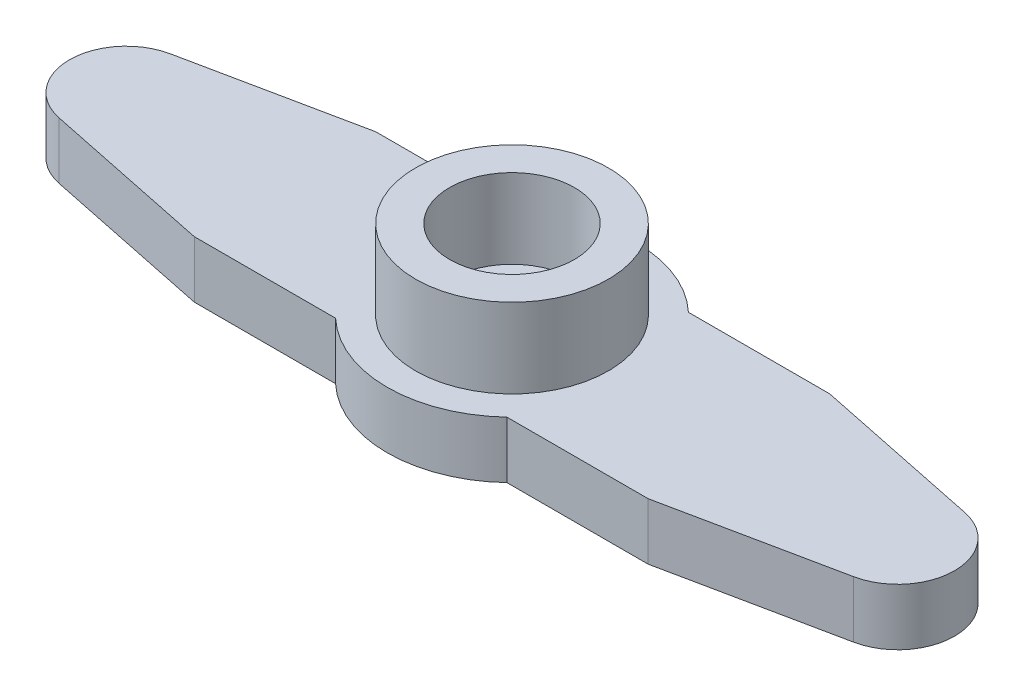
from build123d import *

# Parameters (mm, degrees)
BOSS_EXTRUDE1_DEPTH = 2.5
SKETCH2_R           = 1.5
CUT_EXTRUDE1_DEPTH  = 10
SKETCH3_R           = 4.25
SKETCH3_R_2         = 2.75
BOSS_EXTRUDE2_DEPTH = 3.5
SKETCH4_R           = 3.75
SKETCH4_R_2         = 3.25
BOSS_EXTRUDE3_DEPTH = 0.5


with BuildPart() as part:
    # Sketch1 → Boss-Extrude1 (new body)
    with BuildSketch(Plane(origin=(0, 0, 0), x_dir=(1, 0, 0), z_dir=(0, 1, 0))):
        with BuildLine():
            Line((10, -4), (17.506131517, -2.448230154))
            ThreePointArc((17.506131517, -2.448230154), (19.5, 0), (17.506131517, 2.448230154))
            Line((17.506131517, 2.448230154), (10, 4))
            Line((10, 4), (3.774917218, 4))
            ThreePointArc((3.774917218, 4), (0, 5.5), (-3.774917218, 4))
            Line((-3.774917218, 4), (-10, 4))
            Line((-10, 4), (-17.506131517, 2.448230154))
            ThreePointArc((-17.506131517, 2.448230154), (-19.5, 0), (-17.506131517, -2.448230154))
            Line((-17.506131517, -2.448230154), (-10, -4))
            Line((-10, -4), (-3.774917218, -4))
            ThreePointArc((-3.774917218, -4), (0, -5.5), (3.774917218, -4))
            Line((3.774917218, -4), (10, -4))
        make_face()
    extrude(amount=BOSS_EXTRUDE1_DEPTH)

    # Sketch2 → Cut-Extrude1 (cut)
    with BuildSketch(Plane(origin=(0, 2.5, 0), x_dir=(1, 0, 0), z_dir=(0, 1, 0))):
        with Locations(Location((0, 0, 0), (0, 0, 270))):
            Circle(SKETCH2_R)
    extrude(amount=-CUT_EXTRUDE1_DEPTH, mode=Mode.SUBTRACT)

    # Sketch3 → Boss-Extrude2 (add)
    with BuildSketch(Plane(origin=(0, 2.5, 0), x_dir=(1, 0, 0), z_dir=(0, 1, 0))):
        with Locations(Location((0, 0, 0), (0, 0, 270))):
            Circle(SKETCH3_R)
        with Locations(Location((0, 0, 0), (0, 0, 270))):
            Circle(SKETCH3_R_2, mode=Mode.SUBTRACT)
    extrude(amount=BOSS_EXTRUDE2_DEPTH)

    # Sketch4 → Boss-Extrude3 (add)
    with BuildSketch(Plane.XZ):
        with Locations(Location((0, 0, 0), (0, 0, 90))):
            Circle(SKETCH4_R)
        with Locations(Location((0, 0, 0), (0, 0, 270))):
            Circle(SKETCH4_R_2, mode=Mode.SUBTRACT)
    extrude(amount=BOSS_EXTRUDE3_DEPTH)


solid = part.part
